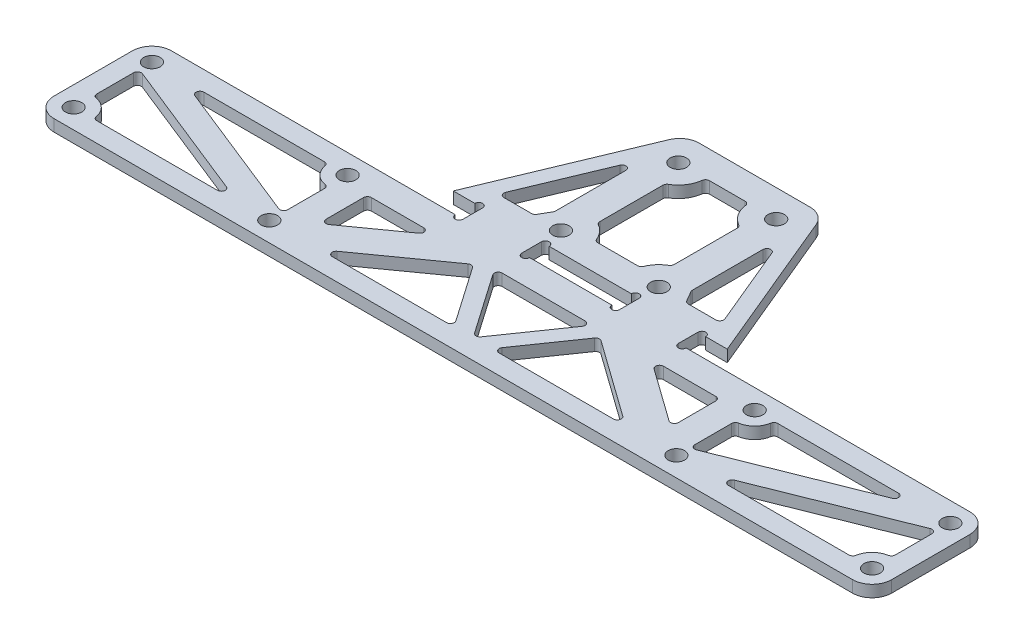
from build123d import *

# Parameters (mm, degrees)
SKETCH_1_R          = 2.1
EXTRUDE_1_DEPTH     = 3
FILLET_1_R          = 5
CUT_EXTRUDE_1_DEPTH = 127.052568399


with BuildPart() as part:
    # 草图1 → 凸台-拉伸1 (new body)
    with BuildSketch(Plane(origin=(0, 0, 0), x_dir=(1, 0, 0), z_dir=(0, 1, 0))):
        with BuildLine():
            Line((-5, 37), (30, 37))
            Line((30, 37), (47.5, -5))
            Line((47.5, -5), (42, -5))
            ThreePointArc((42, -5), (41, -4), (40, -5))
            Line((40, -5), (40, -10))
            ThreePointArc((40, -10), (41, -11), (42, -10))
            Line((42, -10), (119.5, -10))
            Line((119.5, -10), (119.5, -40))
            Line((119.5, -40), (-94.5, -40))
            Line((-94.5, -40), (-94.5, -10))
            Line((-94.5, -10), (-17, -10))
            ThreePointArc((-17, -10), (-16, -11), (-15, -10))
            Line((-15, -10), (-15, -5))
            ThreePointArc((-15, -5), (-16, -4), (-17, -5))
            Line((-17, -5), (-22.5, -5))
            Line((-22.5, -5), (-5, 37))
        make_face()
        with Locations(Location((0, 30, 0), (0, 0, 270))):
            Circle(SKETCH_1_R, mode=Mode.SUBTRACT)
        with Locations(Location((0, 0, 0), (0, 0, 270))):
            Circle(SKETCH_1_R, mode=Mode.SUBTRACT)
        with Locations(Location((-89.5, -15, 0), (0, 0, 270))):
            Circle(SKETCH_1_R, mode=Mode.SUBTRACT)
        with Locations(Location((-39.5, -15, 0), (0, 0, 270))):
            Circle(SKETCH_1_R, mode=Mode.SUBTRACT)
        with Locations(Location((-89.5, -35, 0), (0, 0, 270))):
            Circle(SKETCH_1_R, mode=Mode.SUBTRACT)
        with Locations(Location((-39.5, -35, 0), (0, 0, 270))):
            Circle(SKETCH_1_R, mode=Mode.SUBTRACT)
        with Locations(Location((64.5, -35, 0), (0, 0, 90))):
            Circle(SKETCH_1_R, mode=Mode.SUBTRACT)
        with Locations(Location((114.5, -35, 0), (0, 0, 90))):
            Circle(SKETCH_1_R, mode=Mode.SUBTRACT)
        with Locations(Location((64.5, -15, 0), (0, 0, 90))):
            Circle(SKETCH_1_R, mode=Mode.SUBTRACT)
        with Locations(Location((114.5, -15, 0), (0, 0, 90))):
            Circle(SKETCH_1_R, mode=Mode.SUBTRACT)
        with Locations(Location((25, 0, 0), (0, 0, 90))):
            Circle(SKETCH_1_R, mode=Mode.SUBTRACT)
        with Locations(Location((25, 30, 0), (0, 0, 90))):
            Circle(SKETCH_1_R, mode=Mode.SUBTRACT)
        with BuildLine():
            Line((2, -10), (23, -10))
            ThreePointArc((23, -10), (24, -11), (25, -10))
            Line((25, -10), (25, -5))
            ThreePointArc((25, -5), (24, -4), (23, -5))
            Line((23, -5), (2, -5))
            ThreePointArc((2, -5), (1, -4), (0, -5))
            Line((0, -5), (0, -10))
            ThreePointArc((0, -10), (1, -11), (2, -10))
        make_face(mode=Mode.SUBTRACT)
    extrude(amount=EXTRUDE_1_DEPTH)

    # 圆角1
    fillet_1_edges = [part.edges().sort_by_distance(p)[0] for p in [
        (-5, 1.5, -37),
        (30, 1.5, -37),
        (119.5, 1.5, 10),
        (119.5, 1.5, 40),
        (-94.5, 1.5, 40),
        (-94.5, 1.5, 10),
    ]]
    fillet(fillet_1_edges, radius=FILLET_1_R)

    # 草图2 → 切除-拉伸1 (cut, through all)
    with BuildSketch(Plane(origin=(0, 3, 0), x_dir=(1, 0, 0), z_dir=(0, 1, 0))):
        with BuildLine():
            Line((-89.5, -29.083920217), (-89.5, -19.708131846))
            ThreePointArc((-89.5, -19.708131846), (-89.060628809, -18.880064615), (-88.128609324, -18.779655155))
            Line((-88.128609324, -18.779655155), (-52.398938938, -33.071523309))
            ThreePointArc((-52.398938938, -33.071523309), (-51.788373228, -34.189107521), (-52.770329614, -35))
            Line((-52.770329614, -35), (-83.583920217, -35))
            ThreePointArc((-83.583920217, -35), (-84.229417441, -34.763762616), (-84.569933514, -34.166666667))
            ThreePointArc((-84.569933514, -34.166666667), (-85.964466094, -31.464466094), (-88.666666667, -30.069933514))
            ThreePointArc((-88.666666667, -30.069933514), (-89.263762616, -29.729417441), (-89.5, -29.083920217))
        make_face()
        with BuildLine():
            Line((-45.416079783, -15), (-76.229670386, -15))
            ThreePointArc((-76.229670386, -15), (-77.211626772, -15.810892479), (-76.601061062, -16.928476691))
            Line((-76.601061062, -16.928476691), (-40.871390676, -31.220344845))
            ThreePointArc((-40.871390676, -31.220344845), (-39.939371191, -31.119935385), (-39.5, -30.291868154))
            Line((-39.5, -30.291868154), (-39.5, -20.916079783))
            ThreePointArc((-39.5, -20.916079783), (-39.736237384, -20.270582559), (-40.333333333, -19.930066486))
            ThreePointArc((-40.333333333, -19.930066486), (-43.035533906, -18.535533906), (-44.430066486, -15.833333333))
            ThreePointArc((-44.430066486, -15.833333333), (-44.770582559, -15.236237384), (-45.416079783, -15))
        make_face()
        with BuildLine():
            Line((64.5, -30.291868154), (64.5, -20.916079783))
            ThreePointArc((64.5, -20.916079783), (64.736237384, -20.270582559), (65.333333333, -19.930066486))
            ThreePointArc((65.333333333, -19.930066486), (68.035533906, -18.535533906), (69.430066486, -15.833333333))
            ThreePointArc((69.430066486, -15.833333333), (69.770582559, -15.236237384), (70.416079783, -15))
            Line((70.416079783, -15), (101.229670386, -15))
            ThreePointArc((101.229670386, -15), (102.211626772, -15.810892479), (101.601061062, -16.928476691))
            Line((101.601061062, -16.928476691), (65.871390676, -31.220344845))
            ThreePointArc((65.871390676, -31.220344845), (64.939371191, -31.119935385), (64.5, -30.291868154))
        make_face()
        with BuildLine():
            Line((77.770329614, -35), (108.583920217, -35))
            ThreePointArc((108.583920217, -35), (109.229417441, -34.763762616), (109.569933514, -34.166666667))
            ThreePointArc((109.569933514, -34.166666667), (110.964466094, -31.464466094), (113.666666667, -30.069933514))
            ThreePointArc((113.666666667, -30.069933514), (114.263762616, -29.729417441), (114.5, -29.083920217))
            Line((114.5, -29.083920217), (114.5, -19.708131846))
            ThreePointArc((114.5, -19.708131846), (114.060628809, -18.880064615), (113.128609324, -18.779655155))
            Line((113.128609324, -18.779655155), (77.398938938, -33.071523309))
            ThreePointArc((77.398938938, -33.071523309), (76.788373228, -34.189107521), (77.770329614, -35))
        make_face()
        with BuildLine():
            Line((-14.583333333, 0), (-7.505553499, 0))
            ThreePointArc((-7.505553499, 0), (-7.005553499, 0.133974596), (-6.639528096, 0.5))
            Line((-6.639528096, 0.5), (-5.133974596, 3.107695155))
            ThreePointArc((-5.133974596, 3.107695155), (-5.034074174, 3.348876109), (-5, 3.607695155))
            Line((-5, 3.607695155), (-5, 21.6))
            ThreePointArc((-5, 21.6), (-5.803883865, 22.580580676), (-6.923076923, 21.984615385))
            Line((-6.923076923, 21.984615385), (-15.506410256, 1.384615385))
            ThreePointArc((-15.506410256, 1.384615385), (-15.415383628, 0.445299804), (-14.583333333, 0))
        make_face()
        with BuildLine():
            Line((30, 3.607695155), (30, 21.6))
            ThreePointArc((30, 21.6), (30.803883865, 22.580580676), (31.923076923, 21.984615385))
            Line((31.923076923, 21.984615385), (40.506410256, 1.384615385))
            ThreePointArc((40.506410256, 1.384615385), (40.415383628, 0.445299804), (39.583333333, 0))
            Line((39.583333333, 0), (32.505553499, 0))
            ThreePointArc((32.505553499, 0), (32.005553499, 0.133974596), (31.639528096, 0.5))
            Line((31.639528096, 0.5), (30.133974596, 3.107695155))
            ThreePointArc((30.133974596, 3.107695155), (30.034074174, 3.348876109), (30, 3.607695155))
        make_face()
        with BuildLine():
            Line((3, 23.07179677), (3, 6.92820323))
            ThreePointArc((3, 6.92820323), (3.133974596, 6.42820323), (3.5, 6.062177826))
            ThreePointArc((3.5, 6.062177826), (5.281992573, 4.593533984), (6.489173676, 2.625))
            ThreePointArc((6.489173676, 2.625), (6.857181493, 2.170843802), (7.416198487, 2))
            Line((7.416198487, 2), (17.583801513, 2))
            ThreePointArc((17.583801513, 2), (18.142818507, 2.170843802), (18.510826324, 2.625))
            ThreePointArc((18.510826324, 2.625), (19.718007427, 4.593533984), (21.5, 6.062177826))
            ThreePointArc((21.5, 6.062177826), (21.866025404, 6.42820323), (22, 6.92820323))
            Line((22, 6.92820323), (22, 23.07179677))
            ThreePointArc((22, 23.07179677), (21.866025404, 23.57179677), (21.5, 23.937822174))
            ThreePointArc((21.5, 23.937822174), (19.168900851, 26.127238361), (18.054902808, 29.125))
            ThreePointArc((18.054902808, 29.125), (17.724183895, 29.75), (17.062746067, 30))
            Line((17.062746067, 30), (7.937253933, 30))
            ThreePointArc((7.937253933, 30), (7.275816105, 29.75), (6.945097192, 29.125))
            ThreePointArc((6.945097192, 29.125), (5.831099149, 26.127238361), (3.5, 23.937822174))
            ThreePointArc((3.5, 23.937822174), (3.133974596, 23.57179677), (3, 23.07179677))
        make_face()
        with BuildLine():
            Line((1.911922611, -16.928476691), (23.088077389, -16.928476691))
            ThreePointArc((23.088077389, -16.928476691), (23.974191323, -17.465009221), (23.909447355, -18.4988725))
            Line((23.909447355, -18.4988725), (13.321369966, -33.74570394))
            ThreePointArc((13.321369966, -33.74570394), (12.5, -34.175308131), (11.678630034, -33.74570394))
            Line((11.678630034, -33.74570394), (1.090552645, -18.4988725))
            ThreePointArc((1.090552645, -18.4988725), (1.025808677, -17.465009221), (1.911922611, -16.928476691))
        make_face()
        with BuildLine():
            Line((-32.5, -17.928476691), (-32.5, -27.485287367))
            ThreePointArc((-32.5, -27.485287367), (-31.957581581, -28.37445501), (-30.918761806, -28.299020838))
            Line((-30.918761806, -28.299020838), (-17.53922686, -18.742210162))
            ThreePointArc((-17.53922686, -18.742210162), (-17.168169545, -17.62329926), (-18.120465053, -16.928476691))
            Line((-18.120465053, -16.928476691), (-31.5, -16.928476691))
            ThreePointArc((-31.5, -16.928476691), (-32.207106781, -17.22136991), (-32.5, -17.928476691))
        make_face()
        with BuildLine():
            Line((-23.997185346, -33.186266529), (-4.489724414, -19.252365863))
            ThreePointArc((-4.489724414, -19.252365863), (-3.737550205, -19.080817203), (-3.087116254, -19.495703525))
            Line((-3.087116254, -19.495703525), (6.589203652, -33.429604191))
            ThreePointArc((6.589203652, -33.429604191), (6.653947621, -34.463467469), (5.767833687, -35))
            Line((5.767833687, -35), (-23.415947152, -35))
            ThreePointArc((-23.415947152, -35), (-24.368242661, -34.305177431), (-23.997185346, -33.186266529))
        make_face()
        with BuildLine():
            Line((28.087116254, -19.495703525), (18.410796348, -33.429604191))
            ThreePointArc((18.410796348, -33.429604191), (18.346052379, -34.463467469), (19.232166313, -35))
            Line((19.232166313, -35), (48.415947152, -35))
            ThreePointArc((48.415947152, -35), (49.368242661, -34.305177431), (48.997185346, -33.186266529))
            Line((48.997185346, -33.186266529), (29.489724414, -19.252365863))
            ThreePointArc((29.489724414, -19.252365863), (28.737550205, -19.080817203), (28.087116254, -19.495703525))
        make_face()
        with BuildLine():
            Line((55.918761806, -28.299020838), (42.53922686, -18.742210162))
            ThreePointArc((42.53922686, -18.742210162), (42.168169545, -17.62329926), (43.120465053, -16.928476691))
            Line((43.120465053, -16.928476691), (56.5, -16.928476691))
            ThreePointArc((56.5, -16.928476691), (57.207106781, -17.22136991), (57.5, -17.928476691))
            Line((57.5, -17.928476691), (57.5, -27.485287367))
            ThreePointArc((57.5, -27.485287367), (56.957581581, -28.37445501), (55.918761806, -28.299020838))
        make_face()
    extrude(amount=-CUT_EXTRUDE_1_DEPTH, mode=Mode.SUBTRACT)


solid = part.part
